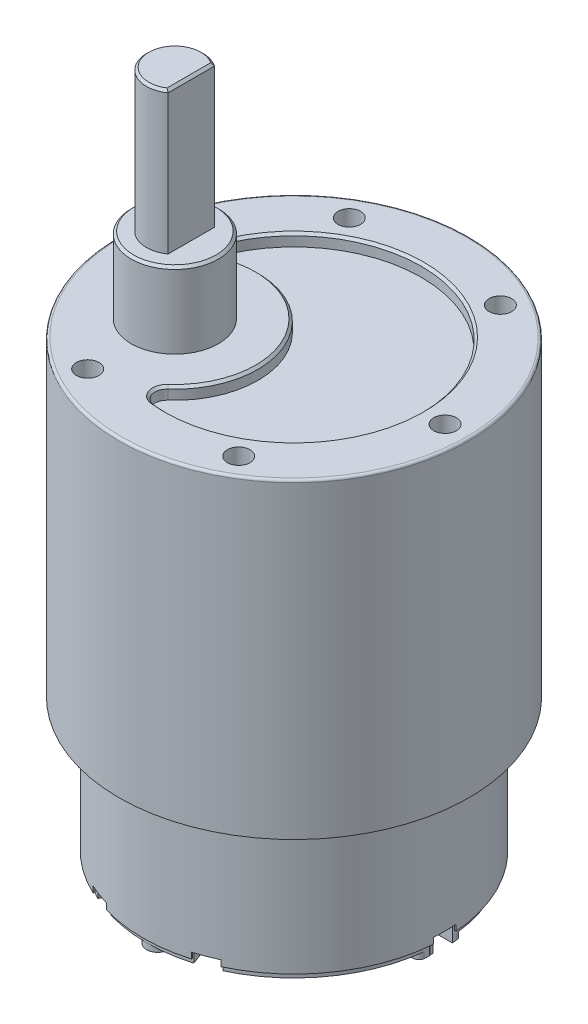
from build123d import *

# Parameters (mm, degrees)
SKETCH1_R           = 18.5
BOSS_EXTRUDE1_DEPTH = 47
SKETCH2_OUTSIDE_W   = 53.066
SKETCH2_OUTSIDE_H   = 53.066
SKETCH2_OUTSIDE_R   = 15.972255
CUT_EXTRUDE1_DEPTH  = 14.1
SKETCH4_R           = 4.607255
BOSS_EXTRUDE2_DEPTH = 8
SKETCH5_R           = 3
BOSS_EXTRUDE3_DEPTH = 15
SKETCH6_OUTSIDE_W   = 56.48
SKETCH6_OUTSIDE_H   = 56.48
CUT_EXTRUDE3_DEPTH  = 15
CUT_EXTRUDE4_DEPTH  = 1.27
CHAMFER2_SIZE       = 0.254
CHAMFER3_SIZE       = 0.254
FILLET1_R           = 0.254
SKETCH9_R           = 18.373
SKETCH9_R_2         = 15.972255
CUT_EXTRUDE5_DEPTH  = 0.254
SKETCH10_R          = 15.833
CUT_EXTRUDE6_DEPTH  = 0.635
CUT_EXTRUDE7_DEPTH  = 0.635
SKETCH13_R          = 15.579
BOSS_EXTRUDE5_DEPTH = 1.27
CUT_EXTRUDE8_DEPTH  = 1.27
SKETCH15_R          = 9.607392
BOSS_EXTRUDE6_DEPTH = 0.762
BOSS_EXTRUDE7_DEPTH = 1.905
SKETCH17_R          = 2.54
BOSS_EXTRUDE8_DEPTH = 1.905
FILLET2_R           = 0.635
FILLET3_R           = 0.635
SKETCH18_W          = 1.91167
SKETCH18_H          = 0.323704
BOSS_EXTRUDE9_DEPTH = 3.175
CUT_EXTRUDE9_REACH  = 77.219
SKETCH19_R          = 0.411483
CUT_EXTRUDE10_REACH = 77.132
SKETCH20_R          = 0.393999
SKETCH3_R           = 1.1938
CUT_EXTRUDE11_DEPTH = 3.175


with BuildPart() as part:
    # Sketch1 → Boss-Extrude1 (new body)
    with BuildSketch(Plane(origin=(0, 0, 0), x_dir=(1, 0, 0), z_dir=(0, 1, 0))):
        with Locations(Location((0, 0, 0), (0, 0, 270))):
            Circle(SKETCH1_R)
    extrude(amount=BOSS_EXTRUDE1_DEPTH)

    # Sketch2 outside → Cut-Extrude1 (cut)
    with BuildSketch(Plane.XZ):
        Rectangle(SKETCH2_OUTSIDE_W, SKETCH2_OUTSIDE_H)
        with Locations(Location((0, 0, 0), (0, 0, 270))):
            Circle(SKETCH2_OUTSIDE_R, mode=Mode.SUBTRACT)
    extrude(amount=-CUT_EXTRUDE1_DEPTH, mode=Mode.SUBTRACT)

    # Sketch4 → Boss-Extrude2 (add)
    with BuildSketch(Plane(origin=(0, 47, 0), x_dir=(1, 0, 0), z_dir=(0, 1, 0))):
        with Locations(Location((-7.98, -4.607255, 0), (0, 0, 270))):
            Circle(SKETCH4_R)
    extrude(amount=BOSS_EXTRUDE2_DEPTH)

    # Sketch5 → Boss-Extrude3 (add)
    with BuildSketch(Plane(origin=(0, 55, 0), x_dir=(1, 0, 0), z_dir=(0, 1, 0))):
        with Locations(Location((-7.98, -4.607255, 0), (0, 0, 270))):
            Circle(SKETCH5_R)
    extrude(amount=BOSS_EXTRUDE3_DEPTH)

    # Sketch6 outside → Cut-Extrude3 (cut)
    with BuildSketch(Plane(origin=(0, 70, 0), x_dir=(1, 0, 0), z_dir=(0, 1, 0))):
        Rectangle(SKETCH6_OUTSIDE_W, SKETCH6_OUTSIDE_H)
        with BuildLine():
            Line((-6.244305, -2.160346), (-6.244305, -7.054164))
            ThreePointArc((-6.244305, -7.054164), (-10.98, -4.607255), (-6.244305, -2.160346))
        make_face(mode=Mode.SUBTRACT)
    extrude(amount=-CUT_EXTRUDE3_DEPTH, mode=Mode.SUBTRACT)

    # Sketch8 → Cut-Extrude4 (cut)
    with BuildSketch(Plane(origin=(0, 47, 0), x_dir=(1, 0, 0), z_dir=(0, 1, 0))):
        with BuildLine():
            ThreePointArc((-2.142659, -11.170116), (-0.373472, -0.215624), (-10.744934, 3.729461))
            ThreePointArc((-10.744934, 3.729461), (-12.085065, 4.081277), (-12.305973, 5.449095))
            ThreePointArc((-12.305973, 5.449095), (11.655351, 6.72922), (-1.433932, -13.381832))
            ThreePointArc((-1.433932, -13.381832), (-2.508043, -12.506612), (-2.142659, -11.170116))
        make_face()
    extrude(amount=-CUT_EXTRUDE4_DEPTH, mode=Mode.SUBTRACT)

    # Chamfer2
    chamfer2_edges = [part.edges().sort_by_distance(p)[0] for p in [
        (-2.508043, 47, 12.506612),
        (11.655351, 47, -6.72922),
        (-12.085065, 47, -4.081277),
        (-0.373472, 47, 0.215624),
    ]]
    chamfer(chamfer2_edges, length=CHAMFER2_SIZE)

    # Chamfer3
    chamfer3_edges = [part.edges().sort_by_distance(p)[0] for p in [
        (-7.98, 55, 0),
        (-10.98, 70, 4.607255),
        (-6.244305, 70, 4.607255),
    ]]
    chamfer(chamfer3_edges, length=CHAMFER3_SIZE)

    # Fillet1
    fillet1_edges = [part.edges().sort_by_distance(p)[0] for p in [
        (0, 47, -18.5),
    ]]
    fillet(fillet1_edges, radius=FILLET1_R)

    # Sketch9 → Cut-Extrude5 (cut)
    with BuildSketch(Plane.XZ.offset(-14.1)):
        with Locations(Location((0, 0, 0), (0, 0, 270))):
            Circle(SKETCH9_R)
        with Locations(Location((0, 0, 0), (0, 0, 270))):
            Circle(SKETCH9_R_2, mode=Mode.SUBTRACT)
    extrude(amount=-CUT_EXTRUDE5_DEPTH, mode=Mode.SUBTRACT)

    # Sketch10 → Cut-Extrude6 (cut)
    with BuildSketch(Plane.XZ):
        with Locations(Location((0, 0, 0), (0, 0, 270))):
            Circle(SKETCH10_R)
    extrude(amount=-CUT_EXTRUDE6_DEPTH, mode=Mode.SUBTRACT)

    # Sketch11 → Cut-Extrude7 (cut)
    with BuildSketch(Plane.XZ):
        with BuildLine():
            Line((-20.069623, 1.1938), (-1.726956, 1.1938))
            Line((-1.726956, 1.1938), (-8.207572, 18.353493))
            ThreePointArc((-8.207572, 18.353493), (-7.103297, 18.808458), (-5.973956, 19.197051))
            Line((-5.973956, 19.197051), (0, 3.378919))
            Line((0, 3.378919), (5.973956, 19.197051))
            ThreePointArc((5.973956, 19.197051), (7.103297, 18.808458), (8.207572, 18.353493))
            Line((8.207572, 18.353493), (1.726956, 1.1938))
            Line((1.726956, 1.1938), (20.069623, 1.1938))
            ThreePointArc((20.069623, 1.1938), (20.105097, 0), (20.069623, -1.1938))
            Line((20.069623, -1.1938), (1.726956, -1.1938))
            Line((1.726956, -1.1938), (8.207572, -18.353493))
            ThreePointArc((8.207572, -18.353493), (7.103297, -18.808458), (5.973956, -19.197051))
            Line((5.973956, -19.197051), (0, -3.378919))
            Line((0, -3.378919), (-5.973956, -19.197051))
            ThreePointArc((-5.973956, -19.197051), (-7.103297, -18.808458), (-8.207572, -18.353493))
            Line((-8.207572, -18.353493), (-1.726956, -1.1938))
            Line((-1.726956, -1.1938), (-20.069623, -1.1938))
            ThreePointArc((-20.069623, -1.1938), (-20.105097, 0), (-20.069623, 1.1938))
        make_face()
    extrude(amount=-CUT_EXTRUDE7_DEPTH, mode=Mode.SUBTRACT)

    # Sketch13 → Boss-Extrude5 (add)
    with BuildSketch(Plane.XZ.offset(-0.635)):
        with Locations(Location((0, 0, 0), (0, 0, 270))):
            Circle(SKETCH13_R)
    extrude(amount=BOSS_EXTRUDE5_DEPTH)

    # Sketch14 → Cut-Extrude8 (cut)
    with BuildSketch(Plane.XZ.offset(0.635)):
        with BuildLine():
            Line((-8.207572, 18.353493), (-6.027655, 12.581401))
            ThreePointArc((-6.027655, 12.581401), (-11.475771, 7.932903), (-13.899608, 1.1938))
            Line((-13.899608, 1.1938), (-20.069623, 1.1938))
            ThreePointArc((-20.069623, 1.1938), (-20.105097, 0), (-20.069623, -1.1938))
            Line((-20.069623, -1.1938), (-13.899608, -1.1938))
            ThreePointArc((-13.899608, -1.1938), (-11.475771, -7.932903), (-6.027655, -12.581401))
            Line((-6.027655, -12.581401), (-8.207572, -18.353493))
            ThreePointArc((-8.207572, -18.353493), (-7.103297, -18.808458), (-5.973956, -19.197051))
            Line((-5.973956, -19.197051), (-3.794038, -13.42496))
            ThreePointArc((-3.794038, -13.42496), (0, -13.95078), (3.794038, -13.42496))
            Line((3.794038, -13.42496), (5.973956, -19.197051))
            ThreePointArc((5.973956, -19.197051), (7.103297, -18.808458), (8.207572, -18.353493))
            Line((8.207572, -18.353493), (6.027655, -12.581401))
            ThreePointArc((6.027655, -12.581401), (11.475771, -7.932903), (13.899608, -1.1938))
            Line((13.899608, -1.1938), (20.069623, -1.1938))
            ThreePointArc((20.069623, -1.1938), (20.105097, 0), (20.069623, 1.1938))
            Line((20.069623, 1.1938), (13.899608, 1.1938))
            ThreePointArc((13.899608, 1.1938), (11.475771, 7.932903), (6.027655, 12.581401))
            Line((6.027655, 12.581401), (8.207572, 18.353493))
            ThreePointArc((8.207572, 18.353493), (7.103297, 18.808458), (5.973956, 19.197051))
            Line((5.973956, 19.197051), (3.794038, 13.42496))
            ThreePointArc((3.794038, 13.42496), (0, 13.95078), (-3.794038, 13.42496))
            Line((-3.794038, 13.42496), (-5.973956, 19.197051))
            ThreePointArc((-5.973956, 19.197051), (-7.103297, 18.808458), (-8.207572, 18.353493))
        make_face()
    extrude(amount=-CUT_EXTRUDE8_DEPTH, mode=Mode.SUBTRACT)

    # Sketch15 → Boss-Extrude6 (add)
    with BuildSketch(Plane.XZ.offset(-0.635)):
        with Locations(Location((0, 0, 0), (0, 0, 90))):
            Circle(SKETCH15_R)
    extrude(amount=BOSS_EXTRUDE6_DEPTH)

    # Sketch16 → Boss-Extrude7 (add)
    with BuildSketch(Plane.XZ.offset(-0.635)):
        with BuildLine():
            Line((-15.409785, 2.28993), (-2.388938, 2.28993))
            ThreePointArc((-2.388938, 2.28993), (-1.829144, 2.757722), (-1.180457, 3.091492))
            Line((-1.180457, 3.091492), (-1.180457, 14.398543))
            ThreePointArc((-1.180457, 14.398543), (0, 15.579), (1.180457, 14.398543))
            Line((1.180457, 14.398543), (1.180457, 3.091492))
            ThreePointArc((1.180457, 3.091492), (1.829144, 2.757722), (2.388938, 2.28993))
            Line((2.388938, 2.28993), (15.409785, 2.28993))
            ThreePointArc((15.409785, 2.28993), (15.481193, 1.742957), (15.533193, 1.1938))
            Line((15.533193, 1.1938), (13.821149, 1.1938))
            Line((13.821149, 1.1938), (13.821149, -1.1938))
            Line((13.821149, -1.1938), (15.533193, -1.1938))
            ThreePointArc((15.533193, -1.1938), (15.481193, -1.742957), (15.409785, -2.28993))
            Line((15.409785, -2.28993), (2.388938, -2.28993))
            ThreePointArc((2.388938, -2.28993), (1.829144, -2.757722), (1.180457, -3.091492))
            Line((1.180457, -3.091492), (1.180457, -14.398543))
            ThreePointArc((1.180457, -14.398543), (0, -15.579), (-1.180457, -14.398543))
            Line((-1.180457, -14.398543), (-1.180457, -3.091492))
            ThreePointArc((-1.180457, -3.091492), (-1.829144, -2.757722), (-2.388938, -2.28993))
            Line((-2.388938, -2.28993), (-15.409785, -2.28993))
            ThreePointArc((-15.409785, -2.28993), (-15.481193, -1.742957), (-15.533193, -1.1938))
            Line((-15.533193, -1.1938), (-13.899608, -1.1938))
            Line((-13.899608, -1.1938), (-13.865941, 1.1938))
            Line((-13.865941, 1.1938), (-15.533193, 1.1938))
            ThreePointArc((-15.533193, 1.1938), (-15.481193, 1.742957), (-15.409785, 2.28993))
        make_face()
    extrude(amount=BOSS_EXTRUDE7_DEPTH)

    # Sketch17 → Boss-Extrude8 (add)
    with BuildSketch(Plane.XZ.offset(1.27)):
        with Locations(Location((0, 0, 0), (0, 0, 90))):
            Circle(SKETCH17_R)
    extrude(amount=BOSS_EXTRUDE8_DEPTH)

    # Fillet2
    fillet2_edges = [part.edges().sort_by_distance(p)[0] for p in [
        (13.761559, 0, 2.28993),
        (9.330499, 0.254, 2.28993),
        (1.180457, 0.254, 9.534595),
        (1.180457, 0, 13.900748),
        (-1.180457, 0, 13.900748),
        (-1.180457, 0.254, 9.534595),
        (-9.330499, 0.254, 2.28993),
        (-13.761559, 0, 2.28993),
        (-13.761559, 0, -2.28993),
        (-9.330499, 0.254, -2.28993),
        (-1.180457, 0.254, -9.534595),
        (-1.180457, 0, -13.900748),
        (1.180457, 0, -13.900748),
        (1.180457, 0.254, -9.534595),
        (9.330499, 0.254, -2.28993),
        (13.761559, 0, -2.28993),
    ]]
    fillet(fillet2_edges, radius=FILLET2_R)

    # Fillet3
    fillet3_edges = [part.edges().sort_by_distance(p)[0] for p in [
        (15.409785, -0.9525, 2.28993),
        (-15.409785, -0.9525, -2.28993),
        (-15.409785, -0.9525, 2.28993),
        (15.409785, -0.9525, -2.28993),
    ]]
    fillet(fillet3_edges, radius=FILLET3_R)

    # Sketch18 → Boss-Extrude9 (add)
    with BuildSketch(Plane.XZ.offset(1.27)):
        with Locations((11.854361, -1.724064)):
            Rectangle(SKETCH18_W, SKETCH18_H)
        with Locations((-11.854361, 1.724064)):
            Rectangle(SKETCH18_W, SKETCH18_H)
    extrude(amount=BOSS_EXTRUDE9_DEPTH)

    # Sketch19 → Cut-Extrude9 (cut, up to next)
    with BuildSketch(Plane.XY.offset(1.885916), mode=Mode.PRIVATE) as cut_extrude9_sk1:
        with Locations((-11.854361, -3.590293)):
            Circle(SKETCH19_R)
    cut_extrude9_tool1 = extrude(cut_extrude9_sk1.sketch, amount=-CUT_EXTRUDE9_REACH, mode=Mode.PRIVATE) & part.part
    # Sketch19 → Cut-Extrude9 (cut, up to next)
    with BuildSketch(Plane.XY.offset(1.885916), mode=Mode.PRIVATE) as cut_extrude9_sk2:
        Polygon((-12.810196, -3.937), (-12.302196, -4.445), (-12.810196, -4.445), align=None)
    cut_extrude9_tool2 = extrude(cut_extrude9_sk2.sketch, amount=-CUT_EXTRUDE9_REACH, mode=Mode.PRIVATE) & part.part
    # Sketch19 → Cut-Extrude9 (cut, up to next)
    with BuildSketch(Plane.XY.offset(1.885916), mode=Mode.PRIVATE) as cut_extrude9_sk3:
        Polygon((-11.406526, -4.445), (-10.898526, -3.937), (-10.898526, -4.445), align=None)
    cut_extrude9_tool3 = extrude(cut_extrude9_sk3.sketch, amount=-CUT_EXTRUDE9_REACH, mode=Mode.PRIVATE) & part.part
    add(cut_extrude9_tool1.solids().sort_by_distance((-11.854361, -3.590293, 1.885916))[0], mode=Mode.SUBTRACT)
    add(cut_extrude9_tool2.solids().sort_by_distance((-12.640862, -4.275667, 1.885916))[0], mode=Mode.SUBTRACT)
    add(cut_extrude9_tool3.solids().sort_by_distance((-11.06786, -4.275667, 1.885916))[0], mode=Mode.SUBTRACT)

    # Sketch20 → Cut-Extrude10 (cut, up to next)
    with BuildSketch(Plane.XY.offset(-1.562212), mode=Mode.PRIVATE) as cut_extrude10_sk1:
        with Locations((11.854361, -3.543001)):
            Circle(SKETCH20_R)
    cut_extrude10_tool1 = extrude(cut_extrude10_sk1.sketch, amount=-CUT_EXTRUDE10_REACH, mode=Mode.PRIVATE) & part.part
    # Sketch20 → Cut-Extrude10 (cut, up to next)
    with BuildSketch(Plane.XY.offset(-1.562212), mode=Mode.PRIVATE) as cut_extrude10_sk2:
        Polygon((10.898526, -3.937), (11.406526, -4.445), (10.898526, -4.445), align=None)
    cut_extrude10_tool2 = extrude(cut_extrude10_sk2.sketch, amount=-CUT_EXTRUDE10_REACH, mode=Mode.PRIVATE) & part.part
    # Sketch20 → Cut-Extrude10 (cut, up to next)
    with BuildSketch(Plane.XY.offset(-1.562212), mode=Mode.PRIVATE) as cut_extrude10_sk3:
        Polygon((12.302196, -4.445), (12.810196, -3.937), (12.810196, -4.445), align=None)
    cut_extrude10_tool3 = extrude(cut_extrude10_sk3.sketch, amount=-CUT_EXTRUDE10_REACH, mode=Mode.PRIVATE) & part.part
    add(cut_extrude10_tool1.solids().sort_by_distance((11.854361, -3.543001, -1.562212))[0], mode=Mode.SUBTRACT)
    add(cut_extrude10_tool2.solids().sort_by_distance((11.06786, -4.275667, -1.562212))[0], mode=Mode.SUBTRACT)
    add(cut_extrude10_tool3.solids().sort_by_distance((12.640862, -4.275667, -1.562212))[0], mode=Mode.SUBTRACT)

    # Sketch3 → Cut-Extrude11 (cut)
    with BuildSketch(Plane(origin=(0, 47, 0), x_dir=(1, 0, 0), z_dir=(0, 1, 0))):
        with Locations(Location((-7.98, 13.821765, 0), (0, 0, 270))):
            Circle(SKETCH3_R)
        with Locations(Location((-15.96, 0, 0), (0, 0, 270))):
            Circle(SKETCH3_R)
        with Locations(Location((7.98, 13.821765, 0), (0, 0, 270))):
            Circle(SKETCH3_R)
        with Locations(Location((15.96, 0, 0), (0, 0, 270))):
            Circle(SKETCH3_R)
        with Locations(Location((7.98, -13.821765, 0), (0, 0, 270))):
            Circle(SKETCH3_R)
        with Locations(Location((-7.98, -13.821765, 0), (0, 0, 270))):
            Circle(SKETCH3_R)
    extrude(amount=-CUT_EXTRUDE11_DEPTH, mode=Mode.SUBTRACT)


solid = part.part
